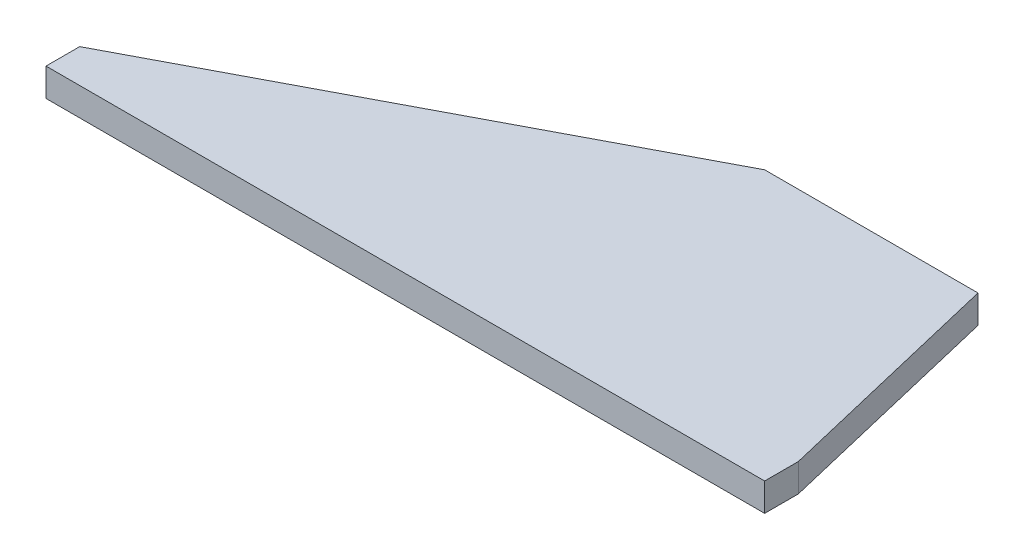
from build123d import *

# Parameters (mm, degrees)
BOSS_EXTRUDE1_DEPTH = 6.35


with BuildPart() as part:
    # Sketch1 → Boss-Extrude1 (new body)
    with BuildSketch(Plane(origin=(0, 0, 0), x_dir=(1, 0, 0), z_dir=(0, 1, 0))):
        Polygon((0, 0), (101.6, 53.34), (149.86, 53.34), (162.56, 0), (162.56, -7.62), (0, -7.62), align=None)
    extrude(amount=BOSS_EXTRUDE1_DEPTH)


solid = part.part
